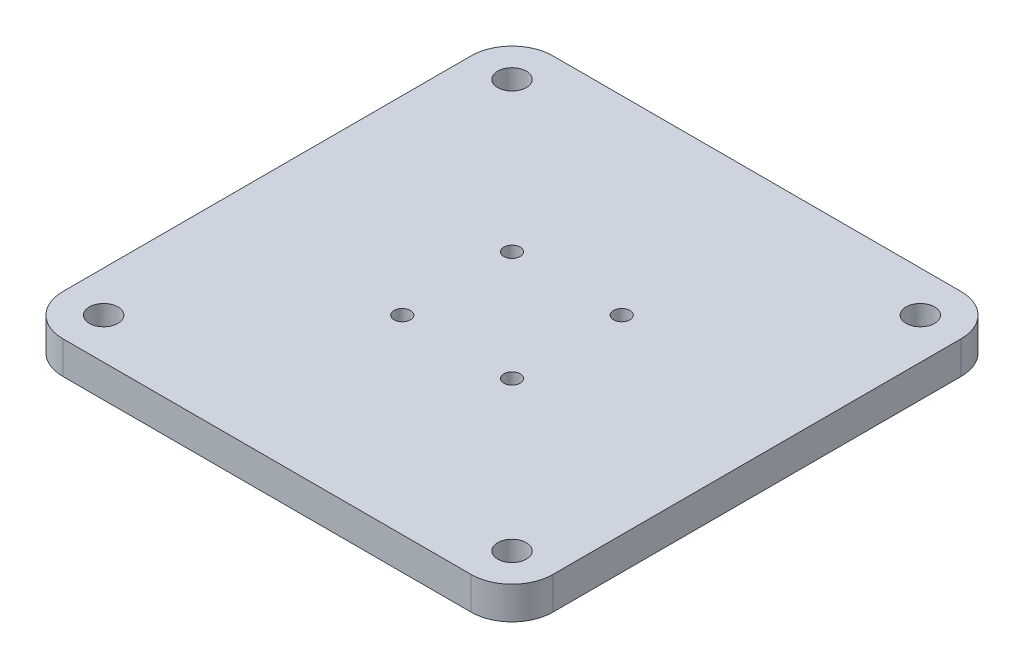
from build123d import *

# Parameters (mm, degrees)
SKETCH_1_W          = 120
SKETCH_1_H          = 120
SKETCH_1_R          = 2
EXTRUDE_1_DEPTH     = 8
SKETCH_2_R          = 3.5
CUT_EXTRUDE_1_DEPTH = 10
SKETCH_3_R          = 3.5
CUT_EXTRUDE_2_DEPTH = 4
FILLET_1_R          = 10


with BuildPart() as part:
    # 草图1 → 凸台-拉伸1 (new body)
    with BuildSketch(Plane(origin=(0, 0, 0), x_dir=(1, 0, 0), z_dir=(0, 1, 0))):
        Rectangle(SKETCH_1_W, SKETCH_1_H)
        with Locations(Location((-13.435028843, 13.435028843, 0), (0, 0, 270))):
            Circle(SKETCH_1_R, mode=Mode.SUBTRACT)
        with Locations(Location((13.435028843, 13.435028843, 0), (0, 0, 270))):
            Circle(SKETCH_1_R, mode=Mode.SUBTRACT)
        with Locations(Location((13.435028843, -13.435028843, 0), (0, 0, 270))):
            Circle(SKETCH_1_R, mode=Mode.SUBTRACT)
        with Locations(Location((-13.435028843, -13.435028843, 0), (0, 0, 270))):
            Circle(SKETCH_1_R, mode=Mode.SUBTRACT)
    extrude(amount=EXTRUDE_1_DEPTH)

    # 草图2 → 切除-拉伸1 (cut)
    with BuildSketch(Plane(origin=(0, 8, 0), x_dir=(1, 0, 0), z_dir=(0, 1, 0))):
        with Locations(Location((-50, 50, 0), (0, 0, 270))):
            Circle(SKETCH_2_R)
        with Locations(Location((50, 50, 0), (0, 0, 270))):
            Circle(SKETCH_2_R)
        with Locations(Location((50, -50, 0), (0, 0, 270))):
            Circle(SKETCH_2_R)
        with Locations(Location((-50, -50, 0), (0, 0, 270))):
            Circle(SKETCH_2_R)
    extrude(amount=-CUT_EXTRUDE_1_DEPTH, mode=Mode.SUBTRACT)

    # 草图3 → 切除-拉伸2 (cut)
    with BuildSketch(Plane.XZ):
        with Locations(Location((-13.435028843, 13.435028843, 0), (0, 0, 270))):
            Circle(SKETCH_3_R)
        with Locations(Location((13.435028843, 13.435028843, 0), (0, 0, 270))):
            Circle(SKETCH_3_R)
        with Locations(Location((-13.435028843, -13.435028843, 0), (0, 0, 270))):
            Circle(SKETCH_3_R)
        with Locations(Location((13.435028843, -13.435028843, 0), (0, 0, 270))):
            Circle(SKETCH_3_R)
    extrude(amount=-CUT_EXTRUDE_2_DEPTH, mode=Mode.SUBTRACT)

    # 圆角1
    fillet_1_edges = [part.edges().sort_by_distance(p)[0] for p in [
        (60, 4, 60),
        (-60, 4, 60),
        (-60, 4, -60),
        (60, 4, -60),
    ]]
    fillet(fillet_1_edges, radius=FILLET_1_R)


solid = part.part
